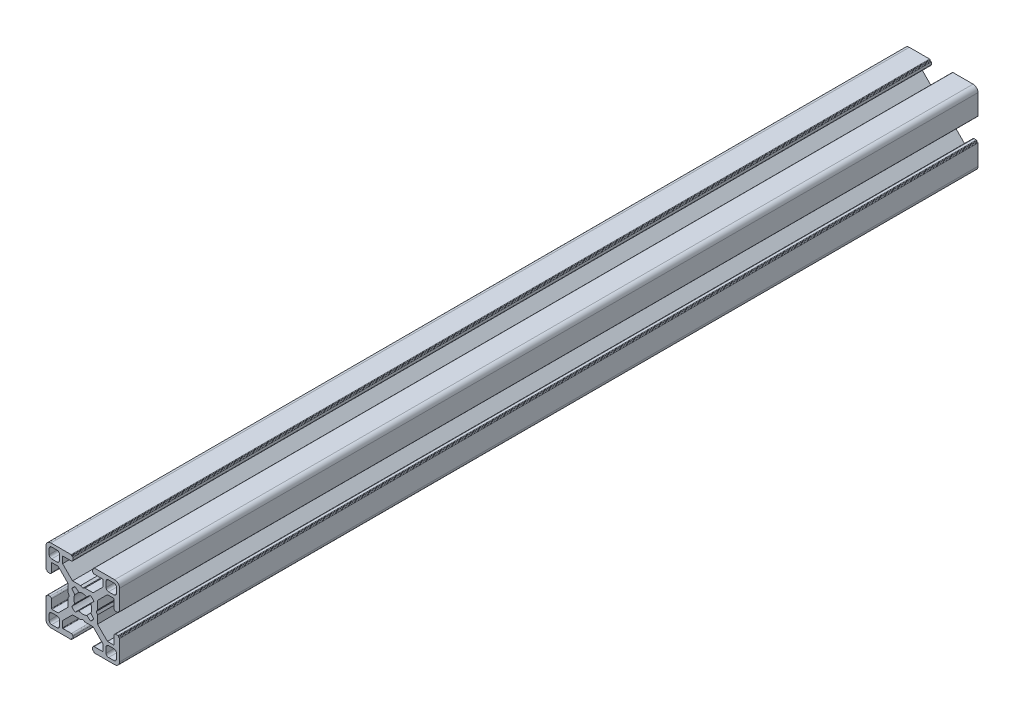
from build123d import *

# Parameters (mm, degrees)
BASE_EXTRUDE_DEPTH = 350


with BuildPart() as part:
    # Sketch1 → Base-Extrude (new body)
    with BuildSketch(Plane.XY):
        with BuildLine():
            Line((6.00446543, 0.899999619), (5.484852164, 0))
            Line((5.484852164, 0), (6.00446543, -0.899999619))
            Line((6.00446543, -0.899999619), (6.00446543, -4.204465866))
            Line((6.00446543, -4.204465866), (10.049999564, -8.25))
            Line((10.049999564, -8.25), (12.59999928, -8.25))
            ThreePointArc((12.59999928, -8.25), (12.741420837, -8.191421273), (12.799999564, -8.049999716))
            Line((12.799999564, -8.049999716), (12.799999564, -4.649999613))
            ThreePointArc((12.799999564, -4.649999613), (12.975735606, -4.225735278), (13.39999994, -4.049999237))
            Line((13.39999994, -4.049999237), (14.300000043, -4.049999237))
            ThreePointArc((14.300000043, -4.049999237), (14.4414216, -4.108577964), (14.500000327, -4.249999521))
            Line((14.500000327, -4.249999521), (14.500000327, -4.349998953))
            ThreePointArc((14.500000327, -4.349998953), (14.558579054, -4.49142051), (14.700000611, -4.549999237))
            Line((14.700000611, -4.549999237), (14.799999716, -4.549999237))
            ThreePointArc((14.799999716, -4.549999237), (14.941421273, -4.608577964), (15, -4.749999521))
            Line((15, -4.749999521), (15, -13.000000346))
            ThreePointArc((15, -13.000000346), (14.414213664, -14.414213664), (13.000000346, -15))
            Line((13.000000346, -15), (4.749999945, -15))
            ThreePointArc((4.749999945, -15), (4.60857832, -14.941421245), (4.549999564, -14.799999619))
            Line((4.549999564, -14.799999619), (4.549999564, -14.69999942))
            ThreePointArc((4.549999564, -14.69999942), (4.49142109, -14.558578474), (4.350000144, -14.5))
            Line((4.350000144, -14.5), (4.250000374, -14.5))
            ThreePointArc((4.250000374, -14.5), (4.108578753, -14.441421247), (4.05, -14.299999626))
            Line((4.05, -14.299999626), (4.05, -13.399999434))
            ThreePointArc((4.05, -13.399999434), (4.225735989, -12.975735226), (4.650000197, -12.799999237))
            Line((4.650000197, -12.799999237), (8.049999924, -12.799999237))
            ThreePointArc((8.049999924, -12.799999237), (8.191421565, -12.741420475), (8.250000327, -12.599998834))
            Line((8.250000327, -12.599998834), (8.250000327, -10.049999237))
            Line((8.250000327, -10.049999237), (4.204466193, -6))
            Line((4.204466193, -6), (0.899999946, -6))
            Line((0.899999946, -6), (0, -5.484851837))
            Line((0, -5.484851837), (-0.899999946, -6))
            Line((-0.899999946, -6), (-4.204466193, -6))
            Line((-4.204466193, -6), (-8.250000327, -10.049999237))
            Line((-8.250000327, -10.049999237), (-8.250000327, -12.599998834))
            ThreePointArc((-8.250000327, -12.599998834), (-8.191421565, -12.741420475), (-8.049999924, -12.799999237))
            Line((-8.049999924, -12.799999237), (-4.650000197, -12.799999237))
            ThreePointArc((-4.650000197, -12.799999237), (-4.225735989, -12.975735226), (-4.05, -13.399999434))
            Line((-4.05, -13.399999434), (-4.05, -14.299999626))
            ThreePointArc((-4.05, -14.299999626), (-4.108578753, -14.441421247), (-4.250000374, -14.5))
            Line((-4.250000374, -14.5), (-4.350000144, -14.5))
            ThreePointArc((-4.350000144, -14.5), (-4.49142109, -14.558578474), (-4.549999564, -14.69999942))
            Line((-4.549999564, -14.69999942), (-4.549999564, -14.799999619))
            ThreePointArc((-4.549999564, -14.799999619), (-4.60857832, -14.941421245), (-4.749999945, -15))
            Line((-4.749999945, -15), (-13.000000346, -15))
            ThreePointArc((-13.000000346, -15), (-14.414213664, -14.414213664), (-15, -13.000000346))
            Line((-15, -13.000000346), (-15, -4.749999521))
            ThreePointArc((-15, -4.749999521), (-14.941421273, -4.608577964), (-14.799999716, -4.549999237))
            Line((-14.799999716, -4.549999237), (-14.700000611, -4.549999237))
            ThreePointArc((-14.700000611, -4.549999237), (-14.558579054, -4.49142051), (-14.500000327, -4.349998953))
            Line((-14.500000327, -4.349998953), (-14.500000327, -4.249999521))
            ThreePointArc((-14.500000327, -4.249999521), (-14.4414216, -4.108577964), (-14.300000043, -4.049999237))
            Line((-14.300000043, -4.049999237), (-13.39999994, -4.049999237))
            ThreePointArc((-13.39999994, -4.049999237), (-12.975735606, -4.225735278), (-12.799999564, -4.649999613))
            Line((-12.799999564, -4.649999613), (-12.799999564, -8.049999716))
            ThreePointArc((-12.799999564, -8.049999716), (-12.741420837, -8.191421273), (-12.59999928, -8.25))
            Line((-12.59999928, -8.25), (-10.049999564, -8.25))
            Line((-10.049999564, -8.25), (-6.00446543, -4.204465866))
            Line((-6.00446543, -4.204465866), (-6.00446543, -0.899999619))
            Line((-6.00446543, -0.899999619), (-5.484852164, 0))
            Line((-5.484852164, 0), (-6.00446543, 0.899999619))
            Line((-6.00446543, 0.899999619), (-6.00446543, 4.204465866))
            Line((-6.00446543, 4.204465866), (-10.049999564, 8.25))
            Line((-10.049999564, 8.25), (-12.59999928, 8.25))
            ThreePointArc((-12.59999928, 8.25), (-12.741420837, 8.191421273), (-12.799999564, 8.049999716))
            Line((-12.799999564, 8.049999716), (-12.799999564, 4.649999613))
            ThreePointArc((-12.799999564, 4.649999613), (-12.975735606, 4.225735278), (-13.39999994, 4.049999237))
            Line((-13.39999994, 4.049999237), (-14.300000043, 4.049999237))
            ThreePointArc((-14.300000043, 4.049999237), (-14.4414216, 4.108577964), (-14.500000327, 4.249999521))
            Line((-14.500000327, 4.249999521), (-14.500000327, 4.349998953))
            ThreePointArc((-14.500000327, 4.349998953), (-14.558579054, 4.49142051), (-14.700000611, 4.549999237))
            Line((-14.700000611, 4.549999237), (-14.799999716, 4.549999237))
            ThreePointArc((-14.799999716, 4.549999237), (-14.941421273, 4.608577964), (-15, 4.749999521))
            Line((-15, 4.749999521), (-15, 13.000000346))
            ThreePointArc((-15, 13.000000346), (-14.414213664, 14.414213664), (-13.000000346, 15))
            Line((-13.000000346, 15), (-4.749999945, 15))
            ThreePointArc((-4.749999945, 15), (-4.60857832, 14.941421245), (-4.549999564, 14.799999619))
            Line((-4.549999564, 14.799999619), (-4.549999564, 14.69999942))
            ThreePointArc((-4.549999564, 14.69999942), (-4.49142109, 14.558578474), (-4.350000144, 14.5))
            Line((-4.350000144, 14.5), (-4.250000374, 14.5))
            ThreePointArc((-4.250000374, 14.5), (-4.108578753, 14.441421247), (-4.05, 14.299999626))
            Line((-4.05, 14.299999626), (-4.05, 13.399999434))
            ThreePointArc((-4.05, 13.399999434), (-4.225735989, 12.975735226), (-4.650000197, 12.799999237))
            Line((-4.650000197, 12.799999237), (-8.049999924, 12.799999237))
            ThreePointArc((-8.049999924, 12.799999237), (-8.191421565, 12.741420475), (-8.250000327, 12.599998834))
            Line((-8.250000327, 12.599998834), (-8.250000327, 10.049999237))
            Line((-8.250000327, 10.049999237), (-4.204466193, 6))
            Line((-4.204466193, 6), (-0.899999946, 6))
            Line((-0.899999946, 6), (0, 5.484851837))
            Line((0, 5.484851837), (0.899999946, 6))
            Line((0.899999946, 6), (4.204466193, 6))
            Line((4.204466193, 6), (8.250000327, 10.049999237))
            Line((8.250000327, 10.049999237), (8.250000327, 12.599998834))
            ThreePointArc((8.250000327, 12.599998834), (8.191421565, 12.741420475), (8.049999924, 12.799999237))
            Line((8.049999924, 12.799999237), (4.650000197, 12.799999237))
            ThreePointArc((4.650000197, 12.799999237), (4.225735989, 12.975735226), (4.05, 13.399999434))
            Line((4.05, 13.399999434), (4.05, 14.299999626))
            ThreePointArc((4.05, 14.299999626), (4.108578753, 14.441421247), (4.250000374, 14.5))
            Line((4.250000374, 14.5), (4.350000144, 14.5))
            ThreePointArc((4.350000144, 14.5), (4.49142109, 14.558578474), (4.549999564, 14.69999942))
            Line((4.549999564, 14.69999942), (4.549999564, 14.799999619))
            ThreePointArc((4.549999564, 14.799999619), (4.60857832, 14.941421245), (4.749999945, 15))
            Line((4.749999945, 15), (13.000000346, 15))
            ThreePointArc((13.000000346, 15), (14.414213664, 14.414213664), (15, 13.000000346))
            Line((15, 13.000000346), (15, 4.749999521))
            ThreePointArc((15, 4.749999521), (14.941421273, 4.608577964), (14.799999716, 4.549999237))
            Line((14.799999716, 4.549999237), (14.700000611, 4.549999237))
            ThreePointArc((14.700000611, 4.549999237), (14.558579054, 4.49142051), (14.500000327, 4.349998953))
            Line((14.500000327, 4.349998953), (14.500000327, 4.249999521))
            ThreePointArc((14.500000327, 4.249999521), (14.4414216, 4.108577964), (14.300000043, 4.049999237))
            Line((14.300000043, 4.049999237), (13.39999994, 4.049999237))
            ThreePointArc((13.39999994, 4.049999237), (12.975735606, 4.225735278), (12.799999564, 4.649999613))
            Line((12.799999564, 4.649999613), (12.799999564, 8.049999716))
            ThreePointArc((12.799999564, 8.049999716), (12.741420837, 8.191421273), (12.59999928, 8.25))
            Line((12.59999928, 8.25), (10.049999564, 8.25))
            Line((10.049999564, 8.25), (6.00446543, 4.204465866))
            Line((6.00446543, 4.204465866), (6.00446543, 0.899999619))
        make_face()
        with BuildLine():
            Line((13.70000109, 12.700000408), (13.70000109, 10.499999626))
            ThreePointArc((13.70000109, 10.499999626), (13.407107874, 9.792892851), (12.7000011, 9.499999635))
            Line((12.7000011, 9.499999635), (10.500000318, 9.499999635))
            ThreePointArc((10.500000318, 9.499999635), (9.792893543, 9.792892851), (9.500000327, 10.499999626))
            Line((9.500000327, 10.499999626), (9.500000327, 12.700000408))
            ThreePointArc((9.500000327, 12.700000408), (9.792893543, 13.407107182), (10.500000318, 13.700000398))
            Line((10.500000318, 13.700000398), (12.7000011, 13.700000398))
            ThreePointArc((12.7000011, 13.700000398), (13.407107874, 13.407107182), (13.70000109, 12.700000408))
        make_face(mode=Mode.SUBTRACT)
        with BuildLine():
            Line((3.135929412, 4.518400903), (1.600129524, 3.280561767))
            ThreePointArc((1.600129524, 3.280561767), (0, 3.65), (-1.600129524, 3.280561767))
            Line((-1.600129524, 3.280561767), (-3.135929412, 4.518400903))
            ThreePointArc((-3.135929412, 4.518400903), (-3.881002259, 3.897155561), (-4.505336892, 3.154669473))
            Line((-4.505336892, 3.154669473), (-3.280561732, 1.600129597))
            ThreePointArc((-3.280561732, 1.600129597), (-3.65, 0), (-3.280561732, -1.600129597))
            Line((-3.280561732, -1.600129597), (-4.505336892, -3.154669473))
            ThreePointArc((-4.505336892, -3.154669473), (-3.881002259, -3.897155561), (-3.135929412, -4.518400903))
            Line((-3.135929412, -4.518400903), (-1.600129524, -3.280561767))
            ThreePointArc((-1.600129524, -3.280561767), (0, -3.65), (1.600129524, -3.280561767))
            Line((1.600129524, -3.280561767), (3.135929412, -4.518400903))
            ThreePointArc((3.135929412, -4.518400903), (3.881002259, -3.897155561), (4.505336892, -3.154669473))
            Line((4.505336892, -3.154669473), (3.280561732, -1.600129597))
            ThreePointArc((3.280561732, -1.600129597), (3.65, 0), (3.280561732, 1.600129597))
            Line((3.280561732, 1.600129597), (4.505336892, 3.154669473))
            ThreePointArc((4.505336892, 3.154669473), (3.881002259, 3.897155561), (3.135929412, 4.518400903))
        make_face(mode=Mode.SUBTRACT)
        with BuildLine():
            Line((-13.70000109, -12.700000408), (-13.70000109, -10.499999626))
            ThreePointArc((-13.70000109, -10.499999626), (-13.407107874, -9.792892851), (-12.7000011, -9.499999635))
            Line((-12.7000011, -9.499999635), (-10.500000318, -9.499999635))
            ThreePointArc((-10.500000318, -9.499999635), (-9.792893543, -9.792892851), (-9.500000327, -10.499999626))
            Line((-9.500000327, -10.499999626), (-9.500000327, -12.700000408))
            ThreePointArc((-9.500000327, -12.700000408), (-9.792893543, -13.407107182), (-10.500000318, -13.700000398))
            Line((-10.500000318, -13.700000398), (-12.7000011, -13.700000398))
            ThreePointArc((-12.7000011, -13.700000398), (-13.407107874, -13.407107182), (-13.70000109, -12.700000408))
        make_face(mode=Mode.SUBTRACT)
        with BuildLine():
            Line((10.500000318, -13.700000398), (12.7000011, -13.700000398))
            ThreePointArc((12.7000011, -13.700000398), (13.407107874, -13.407107182), (13.70000109, -12.700000408))
            Line((13.70000109, -12.700000408), (13.70000109, -10.499999626))
            ThreePointArc((13.70000109, -10.499999626), (13.407107874, -9.792892851), (12.7000011, -9.499999635))
            Line((12.7000011, -9.499999635), (10.500000318, -9.499999635))
            ThreePointArc((10.500000318, -9.499999635), (9.792893543, -9.792892851), (9.500000327, -10.499999626))
            Line((9.500000327, -10.499999626), (9.500000327, -12.700000408))
            ThreePointArc((9.500000327, -12.700000408), (9.792893543, -13.407107182), (10.500000318, -13.700000398))
        make_face(mode=Mode.SUBTRACT)
        with BuildLine():
            Line((-10.500000318, 13.700000398), (-12.7000011, 13.700000398))
            ThreePointArc((-12.7000011, 13.700000398), (-13.407107874, 13.407107182), (-13.70000109, 12.700000408))
            Line((-13.70000109, 12.700000408), (-13.70000109, 10.499999626))
            ThreePointArc((-13.70000109, 10.499999626), (-13.407107874, 9.792892851), (-12.7000011, 9.499999635))
            Line((-12.7000011, 9.499999635), (-10.500000318, 9.499999635))
            ThreePointArc((-10.500000318, 9.499999635), (-9.792893543, 9.792892851), (-9.500000327, 10.499999626))
            Line((-9.500000327, 10.499999626), (-9.500000327, 12.700000408))
            ThreePointArc((-9.500000327, 12.700000408), (-9.792893543, 13.407107182), (-10.500000318, 13.700000398))
        make_face(mode=Mode.SUBTRACT)
    extrude(amount=-BASE_EXTRUDE_DEPTH)


solid = part.part
